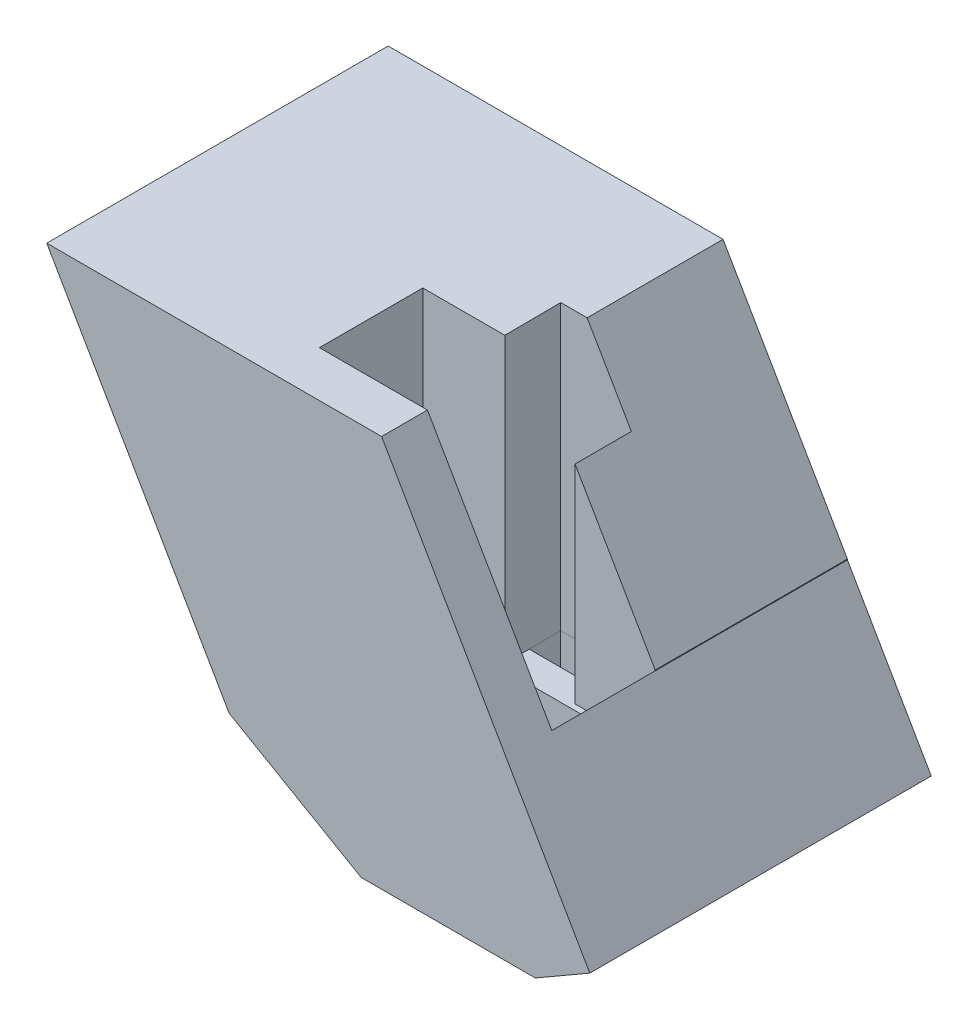
from build123d import *

# Parameters (mm, degrees)
EXTRUDE_1_DEPTH     = 10
EXTRUDE_2_DEPTH     = 64.5
CUT_EXTRUDE_1_REACH = 160.264
SKETCH_4_W          = 45.7
SKETCH_4_H          = 21.3
SKETCH_5_R          = 1.4
SKETCH_5_R_2        = 1.3
EXTRUDE_4_DEPTH     = 3
CUT_EXTRUDE_2_REACH = 160.264
SKETCH_6_W          = 15.410459276
SKETCH_6_H          = 6.940839766
EXTRUDE_7_REACH     = 160.264
CUT_EXTRUDE_3_REACH = 193.728
CUT_EXTRUDE_4_REACH = 193.728
CUT_EXTRUDE_5_REACH = 193.728


with BuildPart() as part:
    # 草圖1 → 填料-伸長1 (new body)
    with BuildSketch(Plane.XY):
        Polygon((85.115442282, 119.023705311), (130.547793458, 40.332564766), (120.155488613, 34.332564766), (120.655488613, 33.466539362), (80.655488613, 33.466539362), (51.851130238, 50.096743424), (12.056130238, 119.023705311), align=None)
        Polygon((51.851130238, 50.096743424), (45.007721115, 46.145699324), (80.655488613, 25.564451164), (80.655488613, 33.466539362), align=None)
    extrude(amount=EXTRUDE_1_DEPTH)

    # 草圖2 → 填料-伸長2 (add)
    with BuildSketch(Plane(origin=(0, 0, 0), x_dir=(-1, 0, 0), z_dir=(0, 0, -1))):
        Polygon((-80.655488613, 33.466539362), (-80.655488613, 25.564451164), (-45.007721115, 46.145699324), (-51.851130238, 50.096743424), (-12.056130238, 119.023705311), (-61.552757034, 119.023705311), (-61.552757034, 57.020497378), (-112.252757034, 57.020497378), (-112.252757034, 72.020497378), (-130.547793458, 40.332564766), (-120.155488613, 34.332564766), (-120.655488613, 33.466539362), align=None)
    extrude(amount=EXTRUDE_2_DEPTH)

    # 草圖4 → 除料-伸長1 (cut, up to next)
    with BuildSketch(Plane(origin=(0, 57.020497378, 0), x_dir=(1, 0, 0), z_dir=(0, 1, 0)), mode=Mode.PRIVATE) as cut_extrude_1_sk1:
        with Locations((86.902757034, 10.65)):
            Rectangle(SKETCH_4_W, SKETCH_4_H)
    cut_extrude_1_tool1 = extrude(cut_extrude_1_sk1.sketch, amount=-CUT_EXTRUDE_1_REACH, mode=Mode.PRIVATE) & part.part
    add(cut_extrude_1_tool1.solids().sort_by_distance((86.902757, 57.020497, -10.65))[0], mode=Mode.SUBTRACT)

    # 草圖5 → 填料-伸長4 (add)
    # profile 1 of 2: a face of its own
    with BuildSketch(Plane(origin=(0, 57.020497378, 0), x_dir=(1, 0, 0), z_dir=(0, 1, 0))):
        with BuildLine():
            Line((64.052757034, 6), (64.052757034, 0))
            Line((64.052757034, 0), (70.052757034, 0))
            Line((70.052757034, 0), (70.052757034, 4.5))
            ThreePointArc((70.052757034, 4.5), (69.613417206, 5.560660172), (68.552757034, 6))
            Line((68.552757034, 6), (64.052757034, 6))
        make_face()
        with Locations(Location((66.552757034, 2.5, 0), (0, 0, 180))):
            Circle(SKETCH_5_R, mode=Mode.SUBTRACT)
    # profile 2 of 2: a face of its own
    with BuildSketch(Plane(origin=(0, 57.020497378, 0), x_dir=(1, 0, 0), z_dir=(0, 1, 0))):
        with BuildLine():
            Line((109.752757034, 15.3), (109.752757034, 21.3))
            Line((109.752757034, 21.3), (103.752757034, 21.3))
            Line((103.752757034, 21.3), (103.752757034, 16.8))
            ThreePointArc((103.752757034, 16.8), (104.192096863, 15.739339828), (105.252757034, 15.3))
            Line((105.252757034, 15.3), (109.752757034, 15.3))
        make_face()
        with Locations(Location((107.252757034, 18.8, 0), (0, 0, 180))):
            Circle(SKETCH_5_R_2, mode=Mode.SUBTRACT)
    extrude(amount=-EXTRUDE_4_DEPTH)

    # 草圖6 → 除料-伸長2 (cut, up to next)
    with BuildSketch(Plane(origin=(0, 57.020497378, 0), x_dir=(1, 0, 0), z_dir=(0, 1, 0)), mode=Mode.PRIVATE) as cut_extrude_2_sk1:
        with Locations((87.057792718, 31.382043144)):
            Rectangle(SKETCH_6_W, SKETCH_6_H)
    cut_extrude_2_tool1 = extrude(cut_extrude_2_sk1.sketch, amount=-CUT_EXTRUDE_2_REACH, mode=Mode.PRIVATE) & part.part
    add(cut_extrude_2_tool1.solids().sort_by_distance((87.057793, 57.020497, -31.382043))[0], mode=Mode.SUBTRACT)

    # 填料-伸長7: up to this face of the body (flat: up to its plane)
    extrude_7_end = Plane(part.part.faces().sort_by_distance((38.998451389, 119.023705311, -25.313032677))[0])
    # 草圖7 → 填料-伸長7 (add, up to the picked face)
    with BuildSketch(Plane(origin=(0, 57.020497378, 0), x_dir=(1, 0, 0), z_dir=(0, 1, 0)), mode=Mode.PRIVATE) as extrude_7_sk1:
        Polygon((94.763022356, 34.85318293), (94.763022356, 22.563502169), (112.252757034, 22.563502169), (112.252757034, 64.5), (61.552757034, 64.5), (61.552757034, 22.563502169), (79.438288953, 22.563502169), (79.35256308, 34.852463027), align=None)
    extrude_7_tool1 = split(extrude(extrude_7_sk1.sketch, amount=EXTRUDE_7_REACH, mode=Mode.PRIVATE), bisect_by=extrude_7_end, keep=Keep.BOTH, mode=Mode.PRIVATE)
    add(extrude_7_tool1.solids().sort_by(Axis((86.885549, 57.020497, -44.976252), (0, 1, 0)))[0])

    # 除料-伸長3: up to this face of the body (flat: up to its plane)
    cut_extrude_3_end = Plane(part.part.faces().sort_by_distance((75.490043398, 78.531685691, -64.5))[0])
    # 草圖9 → 除料-伸長3 (cut, up to the picked face)
    with BuildSketch(Plane.XY.offset(10), mode=Mode.PRIVATE) as cut_extrude_3_sk1:
        Polygon((85.115442282, 119.023705311), (125.857264431, 119.023705311), (125.857264431, 48.688632151), align=None)
    cut_extrude_3_tool1 = split(extrude(cut_extrude_3_sk1.sketch, amount=-CUT_EXTRUDE_3_REACH, mode=Mode.PRIVATE), bisect_by=cut_extrude_3_end, keep=Keep.BOTH, mode=Mode.PRIVATE)
    add(cut_extrude_3_tool1.solids().sort_by(Axis((112.276657, 95.578681, 10), (0, 0, -1)))[0], mode=Mode.SUBTRACT)

    # 草圖10 → 除料-伸長4 (cut, up to next)
    with BuildSketch(Plane(origin=(0, 0, -64.5), x_dir=(-1, 0, 0), z_dir=(0, 0, -1)), mode=Mode.PRIVATE) as cut_extrude_4_sk1:
        Polygon((-120.155488613, 34.332564766), (-118.655488613, 33.466539362), (-120.655488613, 33.466539362), align=None)
    cut_extrude_4_tool1 = extrude(cut_extrude_4_sk1.sketch, amount=-CUT_EXTRUDE_4_REACH, mode=Mode.PRIVATE) & part.part
    add(cut_extrude_4_tool1.solids().sort_by_distance((119.822155, 33.755214, -64.5))[0], mode=Mode.SUBTRACT)

    # 草圖11 → 除料-伸長5 (cut, up to next)
    with BuildSketch(Plane(origin=(0, 0, -64.5), x_dir=(-1, 0, 0), z_dir=(0, 0, -1)), mode=Mode.PRIVATE) as cut_extrude_5_sk1:
        Polygon((-45.007721115, 46.145699324), (-80.655488613, 25.564451164), (-80.655488613, 33.466539362), (-51.851130238, 50.096743424), align=None)
    cut_extrude_5_tool1 = extrude(cut_extrude_5_sk1.sketch, amount=-CUT_EXTRUDE_5_REACH, mode=Mode.PRIVATE) & part.part
    add(cut_extrude_5_tool1.solids().sort_by_distance((64.481905, 38.71348, -64.5))[0], mode=Mode.SUBTRACT)


solid = part.part
